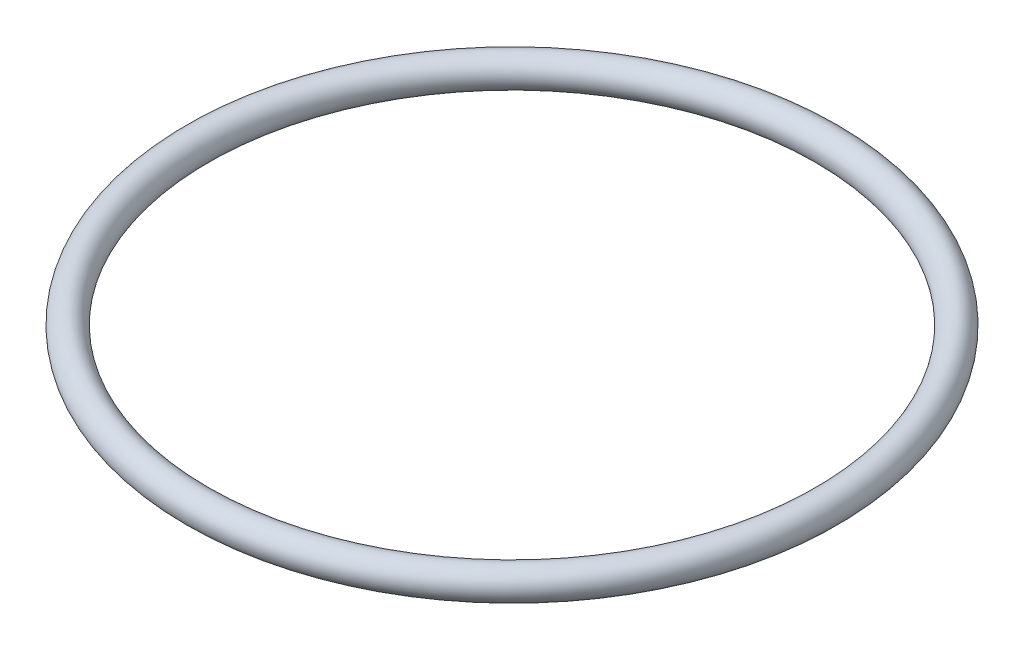
from build123d import *

# Parameters (mm, degrees)
SKETCH2_R = 1


with BuildPart() as part:
    # Sketch2 → Revolve1 (revolve)
    with BuildSketch(Plane.XY, mode=Mode.PRIVATE) as revolve1_sk:
        with Locations((20.5, 0)):
            Circle(SKETCH2_R)
    revolve(revolve1_sk.sketch.rotate(Axis((0, 0, 0), (0, 1, 0)), 90), axis=Axis((0, 0, 0), (0, 1, 0)))


solid = part.part
